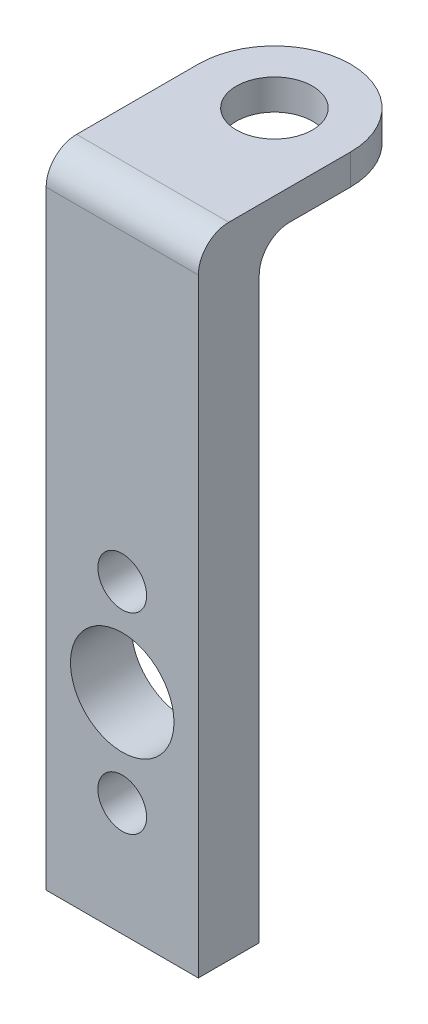
from build123d import *

# Parameters (mm, degrees)
SKETCH2_R           = 3.175
BOSS_EXTRUDE1_DEPTH = 2.54
SKETCH4_W           = 12.7
SKETCH4_H           = 5.08
BOSS_EXTRUDE2_DEPTH = 50.8
FILLET1_R           = 2.54
FILLET2_R           = 2.54
SKETCH5_R           = 4.318
SKETCH5_R_2         = 2.032
CUT_EXTRUDE1_DEPTH  = 55.624765446
CIRPATTERN1_COUNT   = 2


with BuildPart() as part:
    # Sketch2 → Boss-Extrude1 (new body)
    with BuildSketch(Plane(origin=(0, 0, 0), x_dir=(1, 0, 0), z_dir=(0, 1, 0))):
        with BuildLine():
            Line((-6.35, 0), (-6.35, -12.7))
            Line((-6.35, -12.7), (6.35, -12.7))
            Line((6.35, -12.7), (6.35, 0))
            ThreePointArc((6.35, 0), (0, 6.35), (-6.35, 0))
        make_face()
        with Locations(Location((0, 0, 0), (0, 0, 270))):
            Circle(SKETCH2_R, mode=Mode.SUBTRACT)
    extrude(amount=BOSS_EXTRUDE1_DEPTH)

    # Sketch4 → Boss-Extrude2 (add)
    with BuildSketch(Plane.XZ):
        with Locations((0, 10.16)):
            Rectangle(SKETCH4_W, SKETCH4_H)
    extrude(amount=BOSS_EXTRUDE2_DEPTH)

    # Fillet1
    fillet1_edges = [part.edges().sort_by_distance(p)[0] for p in [
        (0, 2.54, 12.7),
    ]]
    fillet(fillet1_edges, radius=FILLET1_R)

    # Fillet2
    fillet2_edges = [part.edges().sort_by_distance(p)[0] for p in [
        (0, 0, 7.62),
    ]]
    fillet(fillet2_edges, radius=FILLET2_R)

    # Sketch5 → Cut-Extrude1 (cut, through all)
    with BuildSketch(Plane.XY.offset(12.7)):
        with Locations((0, -33.3375)):
            Circle(SKETCH5_R)
        with Locations((0, -25.3365)):
            Circle(SKETCH5_R_2)
    cut_extrude1 = extrude(amount=-CUT_EXTRUDE1_DEPTH, mode=Mode.SUBTRACT)

    # CirPattern1: Cut-Extrude1 ×2 about axis
    cirpattern1_axis = Axis((0, -33.3375, 0), (0, 0, 1))
    for i in range(1, CIRPATTERN1_COUNT):
        add(cut_extrude1.rotate(cirpattern1_axis, i * 360 / CIRPATTERN1_COUNT), mode=Mode.SUBTRACT)


solid = part.part
